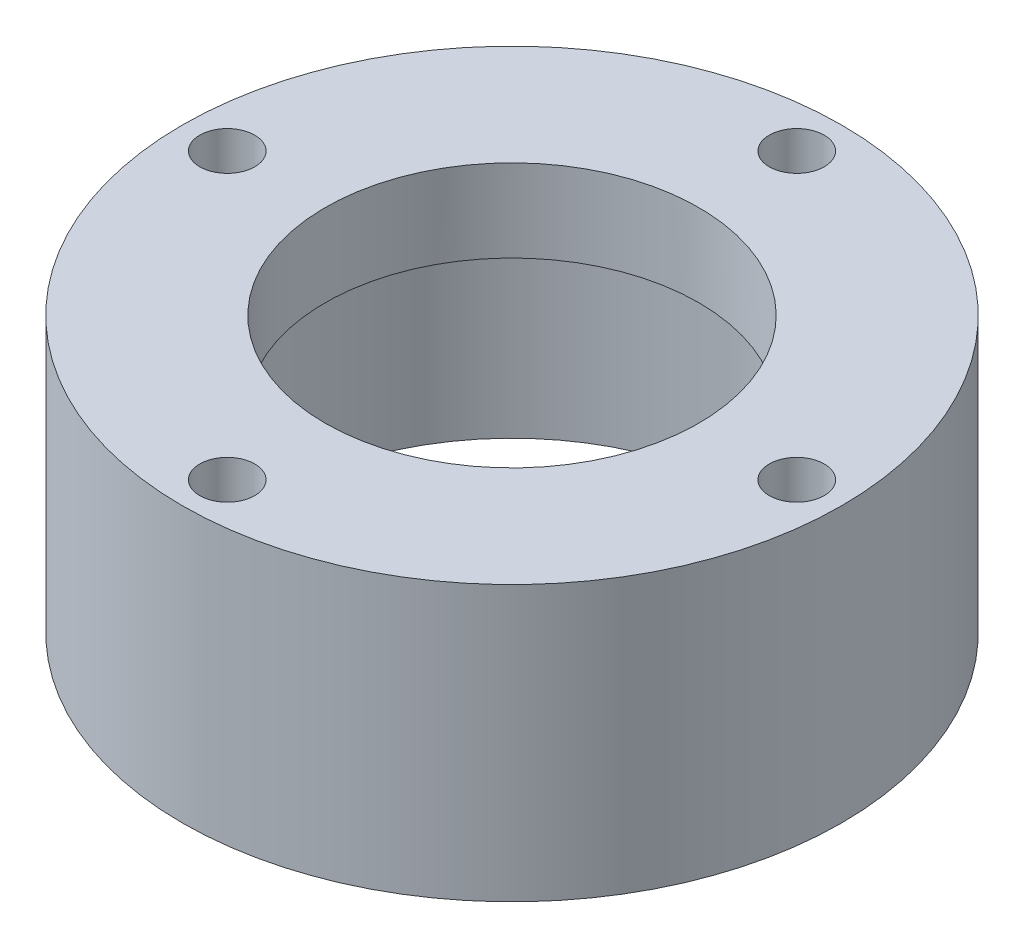
from build123d import *

# Parameters (mm, degrees)
EXTRUDE_START         = -2
SKETCH_1_R            = 18
EXTRUDE_1_DEPTH       = 15
SKETCH_2_R            = 13.000000001
CUT_EXTRUDE_1_DEPTH   = 10.5
SKETCH_3_R            = 10.200000005
CUT_EXTRUDE_2_DEPTH   = 31.64670615
SKETCH_4_R            = 1.5
CUT_EXTRUDE_2_2_DEPTH = 31.64670615


with BuildPart() as part:
    # Эскиз1 → Вытянуть1 (new body)
    with BuildSketch(Plane(origin=(0, 0, 0), x_dir=(1, 0, 0), z_dir=(0, 1, 0)).offset(EXTRUDE_START)):
        with Locations(Location((0, -1.754002071, 0), (0, 0, 270))):
            Circle(SKETCH_1_R)
    extrude(amount=EXTRUDE_1_DEPTH)

    # Эскиз2 → Вырез-Вытянуть1 (cut)
    with BuildSketch(Plane.XZ.offset(2)):
        with Locations(Location((3.8e-08, 1.754001981, 0), (0, 0, 270))):
            Circle(SKETCH_2_R)
    extrude(amount=-CUT_EXTRUDE_1_DEPTH, mode=Mode.SUBTRACT)

    # Эскиз3 → Cut-Extrude 2 (cut, through all)
    with BuildSketch(Plane(origin=(0, 13, 0), x_dir=(1, 0, 0), z_dir=(0, 1, 0))):
        with Locations(Location((3.8e-08, -1.754001981, 0), (0, 0, 270))):
            Circle(SKETCH_3_R)
    extrude(amount=-CUT_EXTRUDE_2_DEPTH, mode=Mode.SUBTRACT)

    # Эскиз4 → Cut-Extrude 2 2 (cut, through all)
    with BuildSketch(Plane(origin=(0, 13, 0), x_dir=(1, 0, 0), z_dir=(0, 1, 0))):
        with Locations(Location((0, 13.791856832, 0), (0, 0, 270))):
            Circle(SKETCH_4_R)
        with Locations(Location((15.545858903, -1.754002071, 0), (0, 0, 270))):
            Circle(SKETCH_4_R)
        with Locations(Location((0, -17.299860974, 0), (0, 0, 270))):
            Circle(SKETCH_4_R)
        with Locations(Location((-15.545858903, -1.754002071, 0), (0, 0, 270))):
            Circle(SKETCH_4_R)
    extrude(amount=-CUT_EXTRUDE_2_2_DEPTH, mode=Mode.SUBTRACT)


solid = part.part
